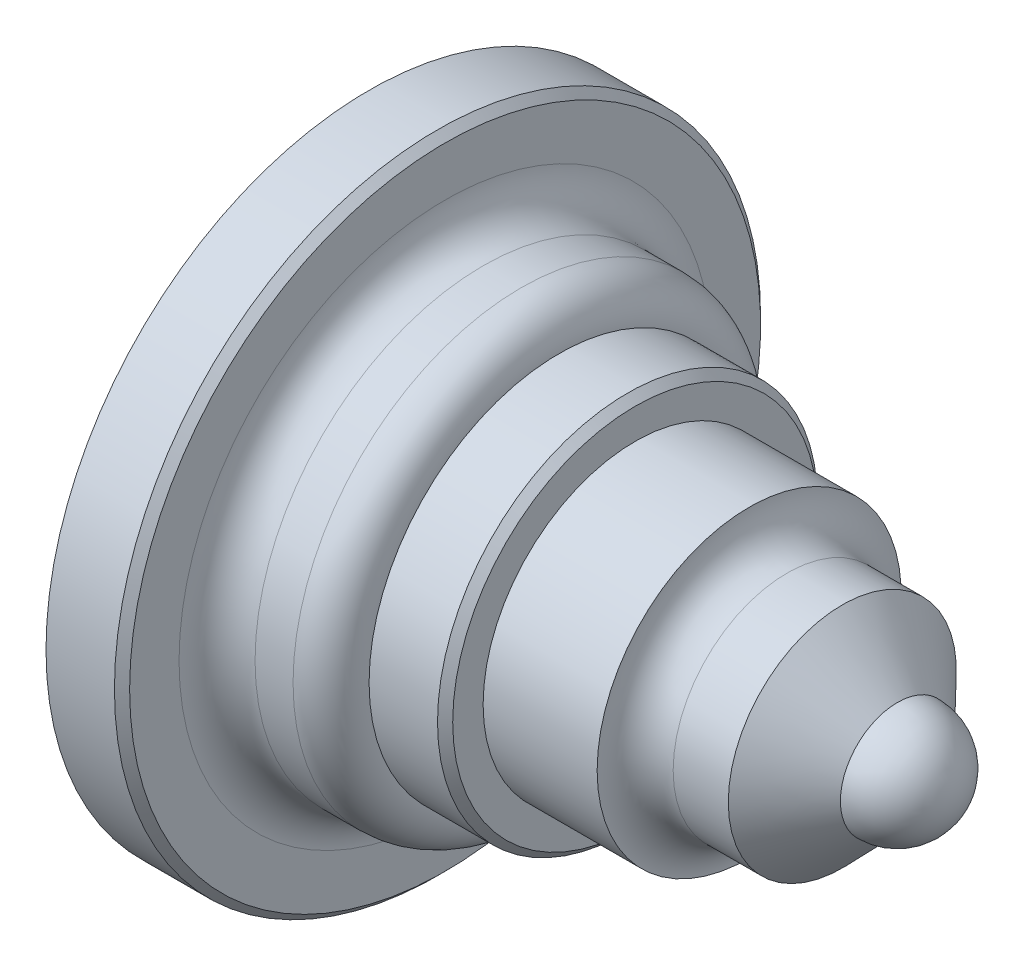
from build123d import *


with BuildPart() as part:
    # Sketch1 → Revolve1 (revolve)
    with BuildSketch(Plane.XY, mode=Mode.PRIVATE) as revolve1_sk:
        with BuildLine():
            ThreePointArc((10, 35), (11.464466094, 31.464466094), (15, 30))
            Line((15, 30), (20, 30))
            ThreePointArc((20, 30), (23.535533906, 28.535533906), (25, 25))
            Line((25, 25), (34, 25))
            Line((34, 25), (35, 24))
            Line((35, 24), (35, 20))
            Line((35, 20), (50, 20))
            ThreePointArc((50, 20), (51.464466094, 16.464466094), (55, 15))
            Line((55, 15), (62.25, 15))
            Line((62.25, 15), (69.5, 7.5))
            ThreePointArc((69.5, 7.5), (74.803300859, 5.303300859), (77, 0))
            Line((77, 0), (0, 0))
            Line((0, 0), (0, 42.5))
            Line((0, 42.5), (9, 42.5))
            Line((9, 42.5), (10, 41.5))
            Line((10, 41.5), (10, 35))
        make_face()
    revolve(revolve1_sk.sketch.rotate(Axis((0, 0, 0), (1, 0, 0)), 90), axis=Axis((0, 0, 0), (1, 0, 0)))


solid = part.part
